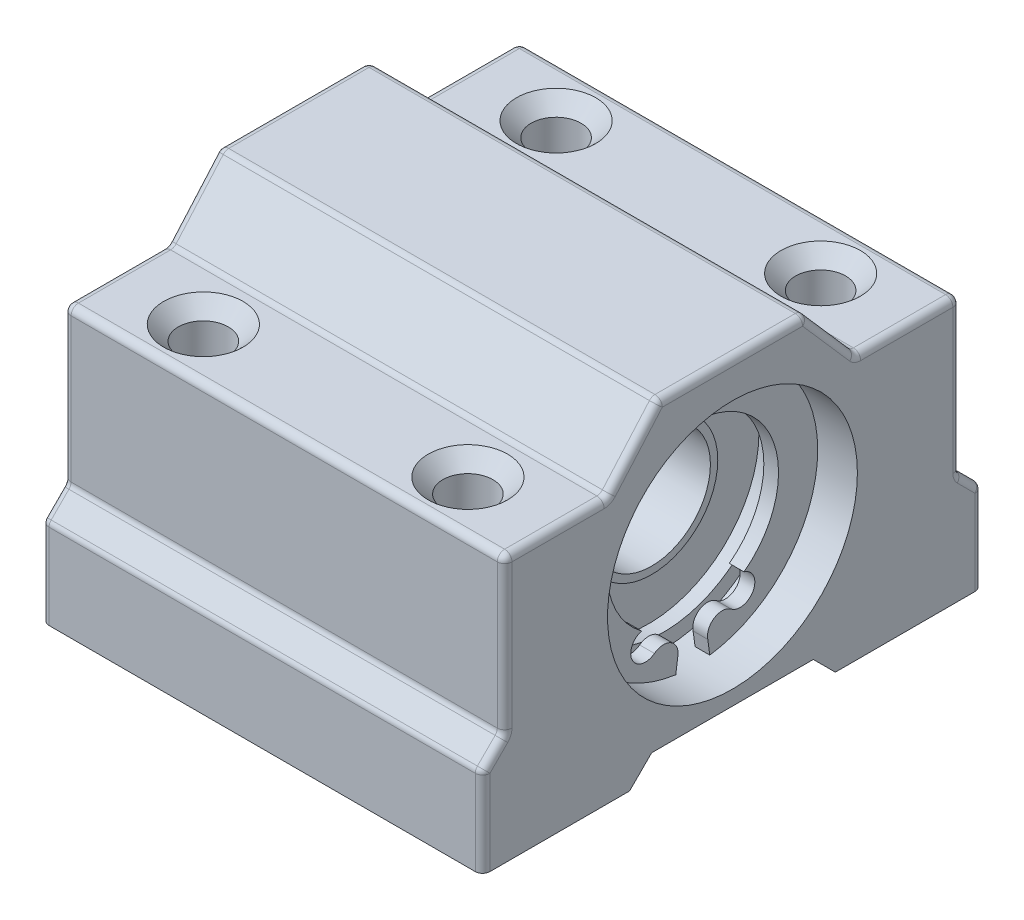
from build123d import *

# Parameters (mm, degrees)
SKETCH1_R           = 8.5
BOSS_EXTRUDE1_DEPTH = 30
EXTRUDE_THIN1_START = 0.5
SKETCH1_4_R         = 4.5
SKETCH1_4_R_2       = 4
EXTRUDE_THIN1_DEPTH = 24
BOSS_EXTRUDE2_START = 0.8
SKETCH1_5_R         = 7.5
SKETCH1_5_R_2       = 4
BOSS_EXTRUDE2_DEPTH = 23.5
BOSS_EXTRUDE3_START = 0.3
SKETCH1_6_R         = 8.5
SKETCH1_6_R_2       = 7.5
BOSS_EXTRUDE3_DEPTH = 25
BOSS_EXTRUDE4_START = 1
BOSS_EXTRUDE4_DEPTH = 1
FILLET1_R           = 0.5
SKETCH4_R           = 1.7
CUT_EXTRUDE3_DEPTH  = 41.902322746
CHAMFER1_SIZE       = 1


with BuildPart() as part:
    # Sketch1 → Boss-Extrude1 (new body)
    with BuildSketch(Plane(origin=(0, 0, 0), x_dir=(0, 0, -1), z_dir=(1, 0, 0))):
        Polygon((-17, -5), (-15.5, -3.5), (-15.5, 7), (-8.5, 7), (-5, 11), (5, 11), (8.5, 7), (15.5, 7), (15.5, -3.5), (17, -5), (17, -11), (7, -11), (5.5, -9.5), (-5.5, -9.5), (-7, -11), (-17, -11), align=None)
        Circle(SKETCH1_R, mode=Mode.SUBTRACT)
    extrude(amount=BOSS_EXTRUDE1_DEPTH)



with BuildPart() as body_2:
    # Sketch1<4> → Extrude-Thin1 (new body)
    with BuildSketch(Plane(origin=(0, 0, 0), x_dir=(0, 0, -1), z_dir=(1, 0, 0)).offset(EXTRUDE_THIN1_START)):
        Circle(SKETCH1_4_R)
        Circle(SKETCH1_4_R_2, mode=Mode.SUBTRACT)
    extrude(amount=EXTRUDE_THIN1_DEPTH)

    # Sketch1<5> → Boss-Extrude2 (add)
    with BuildSketch(Plane(origin=(0, 0, 0), x_dir=(0, 0, -1), z_dir=(1, 0, 0)).offset(BOSS_EXTRUDE2_START)):
        Circle(SKETCH1_5_R)
        Circle(SKETCH1_5_R_2, mode=Mode.SUBTRACT)
    extrude(amount=BOSS_EXTRUDE2_DEPTH)


with BuildPart() as part_1:
    add(part.part)

    add(body_2.part)  # Boss-Extrude3 merges body 2
    # Sketch1<6> → Boss-Extrude3 (add)
    with BuildSketch(Plane(origin=(0, 0, 0), x_dir=(0, 0, -1), z_dir=(1, 0, 0)).offset(BOSS_EXTRUDE3_START)):
        Circle(SKETCH1_6_R)
        Circle(SKETCH1_6_R_2, mode=Mode.SUBTRACT)
    extrude(amount=BOSS_EXTRUDE3_DEPTH)

    # Sketch3 → Boss-Extrude4 (add)
    with BuildSketch(Plane(origin=(25.3, 0, 0), x_dir=(0, 0, -1), z_dir=(1, 0, 0)).offset(BOSS_EXTRUDE4_START)):
        with BuildLine():
            Line((-1.020577541, -7.430236974), (-1.156654546, -8.420935237))
            ThreePointArc((-1.156654546, -8.420935237), (0, 8.5), (1.156654546, -8.420935237))
            Line((1.156654546, -8.420935237), (1.020577541, -7.430236974))
            ThreePointArc((1.020577541, -7.430236974), (1.470233465, -6.380272635), (2.611031056, -6.436809522))
            ThreePointArc((2.611031056, -6.436809522), (4.117409452, -6.090571441), (3.484752301, -4.680322664))
            ThreePointArc((3.484752301, -4.680322664), (0, 5.835145143), (-3.484752301, -4.680322664))
            ThreePointArc((-3.484752301, -4.680322664), (-4.117409452, -6.090571441), (-2.611031056, -6.436809522))
            ThreePointArc((-2.611031056, -6.436809522), (-1.470233465, -6.380272635), (-1.020577541, -7.430236974))
        make_face()
    extrude(amount=BOSS_EXTRUDE4_DEPTH)

    # Fillet1
    fillet1_edges = [part_1.edges().sort_by_distance(p)[0] for p in [
        (30, -4.25, 16.25),
        (30, -8, 17),
        (0, 1.75, 15.5),
        (0, 7, 12),
        (0, 9, 6.75),
        (0, 11, 0),
        (0, 9, -6.75),
        (0, 7, -12),
        (0, 1.75, -15.5),
        (0, -4.25, -16.25),
        (0, -8, -17),
        (0, -8, 17),
        (0, -4.25, 16.25),
        (15, -3.5, 15.5),
        (15, 7, 15.5),
        (15, 7, 8.5),
        (15, 11, 5),
        (15, 11, -5),
        (15, 7, -8.5),
        (15, 7, -15.5),
        (15, -3.5, -15.5),
        (15, -5, -17),
        (15, -5, 17),
        (30, -8, -17),
        (30, -4.25, -16.25),
        (30, 1.75, -15.5),
        (30, 7, -12),
        (30, 9, -6.75),
        (30, 11, 0),
        (30, 9, 6.75),
        (30, 7, 12),
        (30, 1.75, 15.5),
    ]]
    fillet(fillet1_edges, radius=FILLET1_R)

    # Sketch4 → Cut-Extrude3 (cut, through all)
    with BuildSketch(Plane.XZ.offset(11)):
        with Locations(Location((6, 12, 0), (0, 0, 270))):
            Circle(SKETCH4_R)
        with Locations(Location((24, 12, 0), (0, 0, 270))):
            Circle(SKETCH4_R)
        with Locations(Location((24, -12, 0), (0, 0, 270))):
            Circle(SKETCH4_R)
        with Locations(Location((6, -12, 0), (0, 0, 270))):
            Circle(SKETCH4_R)
    extrude(amount=-CUT_EXTRUDE3_DEPTH, mode=Mode.SUBTRACT)

    # Chamfer1
    chamfer1_edges = [part_1.edges().sort_by_distance(p)[0] for p in [
        (6, 7, -10.3),
        (24, 7, -10.3),
        (24, 7, 13.7),
        (24, -11, 13.7),
        (6, 7, 13.7),
        (6, -11, 13.7),
    ]]
    chamfer(chamfer1_edges, length=CHAMFER1_SIZE)


solid = part_1.part
